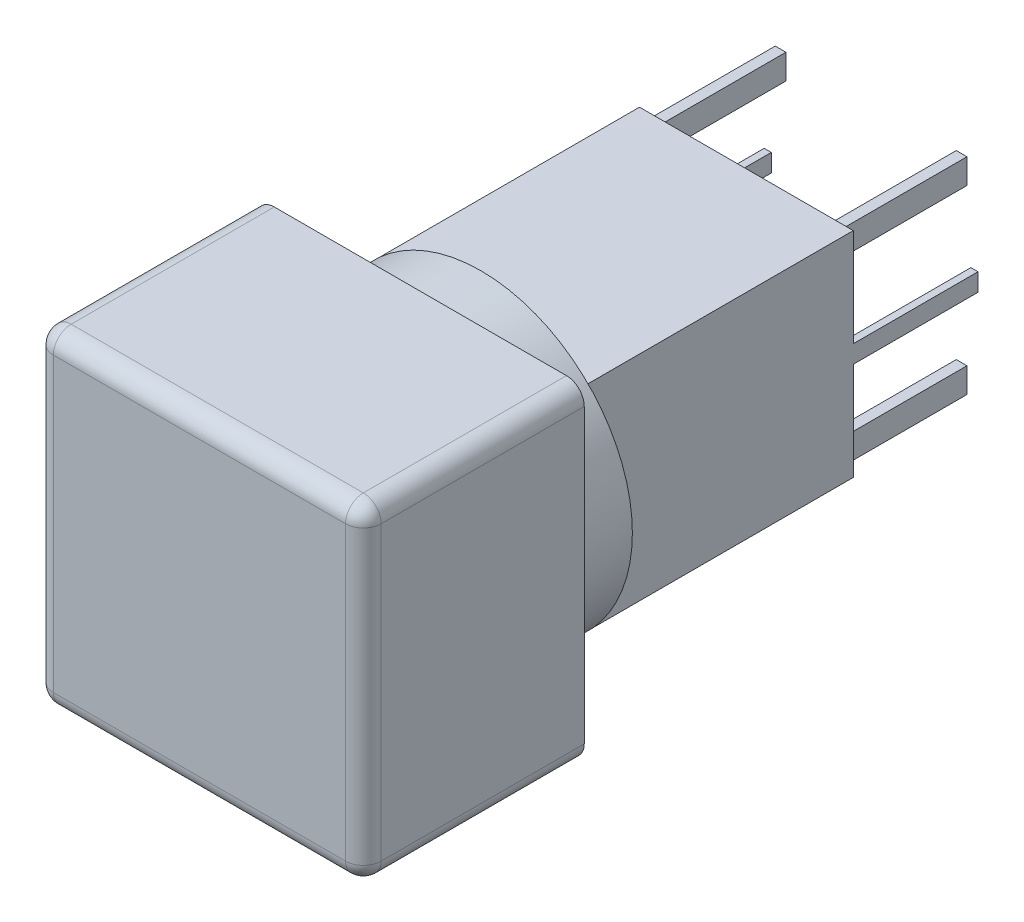
from build123d import *

# Parameters (mm, degrees)
SKETCH_1_W      = 9.2
SKETCH_1_H      = 9.2
EXTRUDE_1_DEPTH = 6.2
FILLET_1_R      = 0.5
SKETCH_2_R      = 4.25
EXTRUDE_2_DEPTH = 1.7
SKETCH_3_W      = 6
SKETCH_3_H      = 6
EXTRUDE_3_DEPTH = 7.45
SKETCH_4_W      = 0.3
SKETCH_4_H      = 0.7
SKETCH_4_W_2    = 0.2
SKETCH_4_H_2    = 0.5
EXTRUDE_4_DEPTH = 3.5


with BuildPart() as part:
    # Эскиз1 → Бобышка-Вытянуть1 (new body)
    with BuildSketch(Plane.XY):
        Rectangle(SKETCH_1_W, SKETCH_1_H)
    extrude(amount=EXTRUDE_1_DEPTH)

    # Скругление1
    fillet_1_edges = [part.edges().sort_by_distance(p)[0] for p in [
        (-4.6, 0, 6.2),
        (0, -4.6, 6.2),
        (4.6, 0, 6.2),
        (4.6, -4.6, 3.1),
        (-4.6, -4.6, 3.1),
        (-4.6, 4.6, 3.1),
        (4.6, 4.6, 3.1),
        (0, 4.6, 6.2),
    ]]
    fillet(fillet_1_edges, radius=FILLET_1_R)

    # Эскиз2 → Бобышка-Вытянуть2 (add)
    with BuildSketch(Plane(origin=(0, 0, 0), x_dir=(-1, 0, 0), z_dir=(0, 0, -1))):
        Circle(SKETCH_2_R)
    extrude(amount=EXTRUDE_2_DEPTH)

    # Эскиз3 → Бобышка-Вытянуть3 (add)
    with BuildSketch(Plane(origin=(0, 0, -1.7), x_dir=(-1, 0, 0), z_dir=(0, 0, -1))):
        Rectangle(SKETCH_3_W, SKETCH_3_H)
    extrude(amount=EXTRUDE_3_DEPTH)

    # Эскиз4 → Бобышка-Вытянуть4 (add)
    with BuildSketch(Plane(origin=(0, 0, -9.15), x_dir=(-1, 0, 0), z_dir=(0, 0, -1))):
        with Locations((-2.54, 2.54)):
            Rectangle(SKETCH_4_W, SKETCH_4_H)
        with Locations((2.54, 2.54)):
            Rectangle(SKETCH_4_W, SKETCH_4_H)
        with Locations((2.54, -2.54)):
            Rectangle(SKETCH_4_W, SKETCH_4_H)
        with Locations((-2.54, -2.54)):
            Rectangle(SKETCH_4_W, SKETCH_4_H)
        with Locations((2.9, 0)):
            Rectangle(SKETCH_4_W_2, SKETCH_4_H_2)
        with Locations((-2.9, 0)):
            Rectangle(SKETCH_4_W_2, SKETCH_4_H_2)
    extrude(amount=EXTRUDE_4_DEPTH)


solid = part.part
